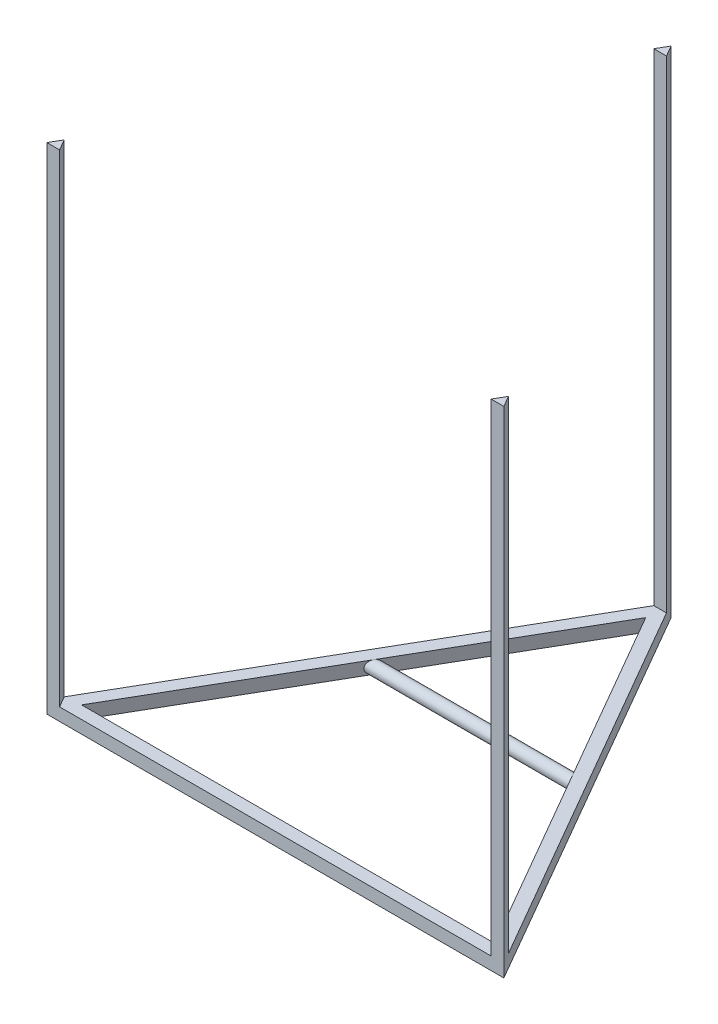
from build123d import *

# Parameters (mm, degrees)
EXTRUDE_1_DEPTH      = 10
EXTRUDE_2_DEPTH      = 380
CUT_EXTRUDE_1_DEPTH  = 10
EXTRUDE_3_DEPTH      = 85
EXTRUDE_3_DEPTH_BACK = 85
SKETCH_5_R           = 5


with BuildPart() as part:
    # 草图1 → 凸台-拉伸1 (new body)
    with BuildSketch(Plane(origin=(0, 0, 0), x_dir=(1, 0, 0), z_dir=(0, 1, 0))):
        Polygon((0, 0), (360, 0), (180, 311.769145362), align=None)
    extrude(amount=EXTRUDE_1_DEPTH)

    # 草图2 → 凸台-拉伸2 (add)
    with BuildSketch(Plane(origin=(0, 10, 0), x_dir=(1, 0, 0), z_dir=(0, 1, 0))):
        Polygon((360, 0), (355, 8.660254038), (350, 0), align=None)
        Polygon((0, 0), (5, 8.660254038), (10, 0), align=None)
        Polygon((180, 311.769145362), (175, 303.108891325), (185, 303.108891325), align=None)
    extrude(amount=EXTRUDE_2_DEPTH)

    # 草图4 → 切除-拉伸1 (cut)
    with BuildSketch(Plane(origin=(0, 0, 0), x_dir=(-1, 0, 0), z_dir=(0, -1, 0))):
        Polygon((-180, 291.769145362), (-342.679491924, 10), (-17.320508076, 10), align=None)
    extrude(amount=-CUT_EXTRUDE_1_DEPTH, mode=Mode.SUBTRACT)

    # 草图5 → 凸台-拉伸3 (add, two sides: drawn at the far end of the back side and taken through both)
    with BuildSketch(Plane.ZY.offset(-180).offset(-EXTRUDE_3_DEPTH_BACK)):
        with Locations((-156, 5)):
            Circle(SKETCH_5_R)
    extrude(amount=EXTRUDE_3_DEPTH + EXTRUDE_3_DEPTH_BACK)


solid = part.part
